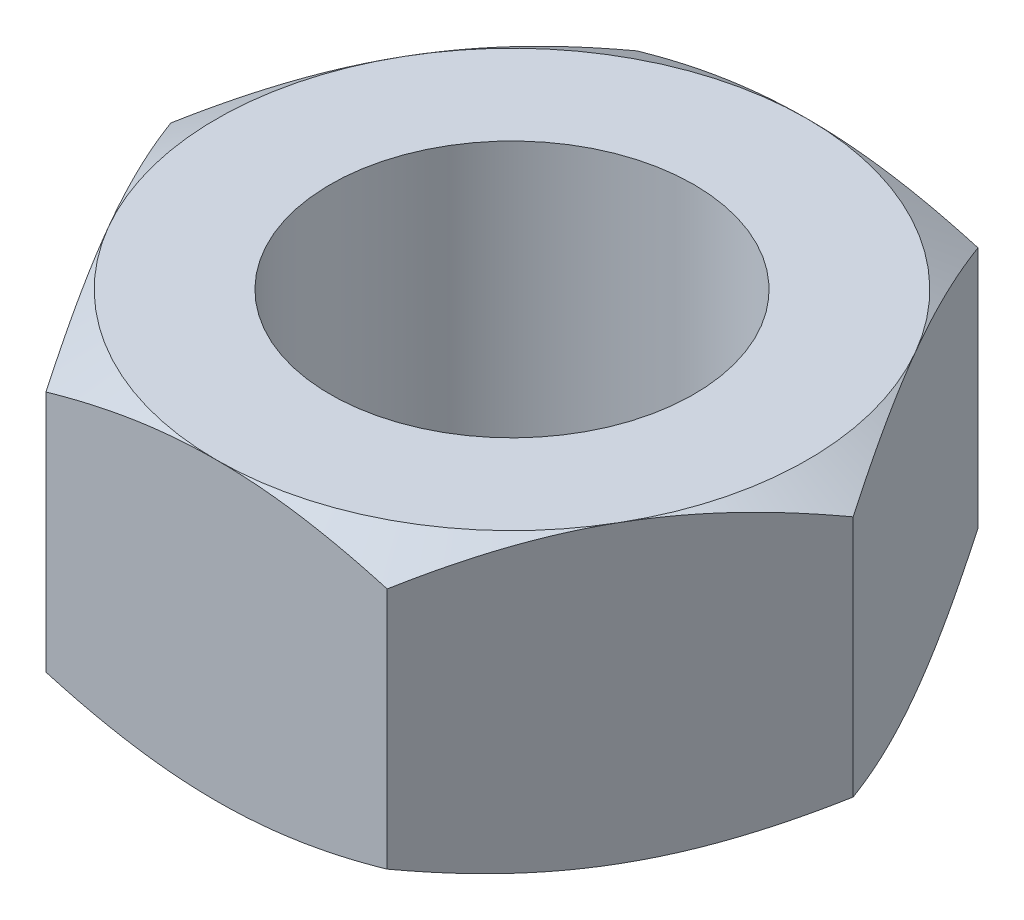
from build123d import *

# Parameters (mm, degrees)
SKETCH1_R               = 4
BOSS_EXTRUDE1_DEPTH     = 3.25
SKETCH2_OUTSIDE_W       = 65.764
SKETCH2_OUTSIDE_H       = 63.752
SKETCH2_OUTSIDE_R       = 6.5
CUT_EXTRUDE1_DEPTH      = 12.867322079
CUT_EXTRUDE1_DRAFT      = -60
MIRROR1_COPY_1_SKETCH_W = 65.764
MIRROR1_COPY_1_SKETCH_H = 63.752
MIRROR1_COPY_1_SKETCH_R = 6.5
MIRROR1_COPY_1_DEPTH    = 12.867322079
MIRROR1_COPY_1_DRAFT    = -60


with BuildPart() as part:
    # Sketch1 → Boss-Extrude1 (new, symmetric)
    with BuildSketch(Plane(origin=(0, 0, 0), x_dir=(1, 0, 0), z_dir=(0, 1, 0))):
        Polygon((-3.75277675, -6.5), (3.75277675, -6.5), (7.505553499, 0), (3.75277675, 6.5), (-3.75277675, 6.5), (-7.505553499, 0), align=None)
        with Locations(Location((0, 0, 0), (0, 0, 90))):
            Circle(SKETCH1_R, mode=Mode.SUBTRACT)
    extrude(amount=BOSS_EXTRUDE1_DEPTH, both=True)


with BuildPart() as cut_extrude1_tool:
    # Sketch2 outside → Cut-Extrude1 (with draft: the straight prism first)
    with BuildSketch(Plane(origin=(0, 3.25, 0), x_dir=(1, 0, 0), z_dir=(0, 1, 0))):
        Rectangle(SKETCH2_OUTSIDE_W, SKETCH2_OUTSIDE_H)
        Circle(SKETCH2_OUTSIDE_R, mode=Mode.SUBTRACT)
    extrude(amount=-CUT_EXTRUDE1_DEPTH)
    # Cut-Extrude1: the draft: its side faces are tilted about the plane it starts from
    cut_extrude1_sides = [cut_extrude1_tool.faces().sort_by_distance(p)[0] for p in [
        (0, -3.18366104, 31.876),
        (32.882, -3.18366104, 0),
        (0, -3.18366104, -31.876),
        (-32.882, -3.18366104, 0),
        (-6.5, -3.18366104, 0),
    ]]
    draft(cut_extrude1_sides, Plane(origin=(0, 3.25, 0), x_dir=(1, 0, 0), z_dir=(0, 1, 0)), CUT_EXTRUDE1_DRAFT)


with BuildPart() as part_1:
    add(part.part)

    # Cut-Extrude1: cut by cut_extrude1_tool
    add(cut_extrude1_tool.part, mode=Mode.SUBTRACT)


with BuildPart() as mirror1_copy_1_tool:
    # Mirror1 copy 1 sketch → Mirror1 copy 1 (with draft: the straight prism first)
    with BuildSketch(Plane.XZ.offset(3.25)):
        Rectangle(MIRROR1_COPY_1_SKETCH_W, MIRROR1_COPY_1_SKETCH_H)
        Circle(MIRROR1_COPY_1_SKETCH_R, mode=Mode.SUBTRACT)
    extrude(amount=-MIRROR1_COPY_1_DEPTH)
    # Mirror1 copy 1: the draft: its side faces are tilted about the plane it starts from
    mirror1_copy_1_sides = [mirror1_copy_1_tool.faces().sort_by_distance(p)[0] for p in [
        (0, 3.18366104, 31.876),
        (32.882, 3.18366104, 0),
        (0, 3.18366104, -31.876),
        (-32.882, 3.18366104, 0),
        (-6.5, 3.18366104, 0),
    ]]
    draft(mirror1_copy_1_sides, Plane.XZ.offset(3.25), MIRROR1_COPY_1_DRAFT)


with BuildPart() as part_2:
    add(part_1.part)

    # Mirror1 copy 1: cut by mirror1_copy_1_tool
    add(mirror1_copy_1_tool.part, mode=Mode.SUBTRACT)


solid = part_2.part
